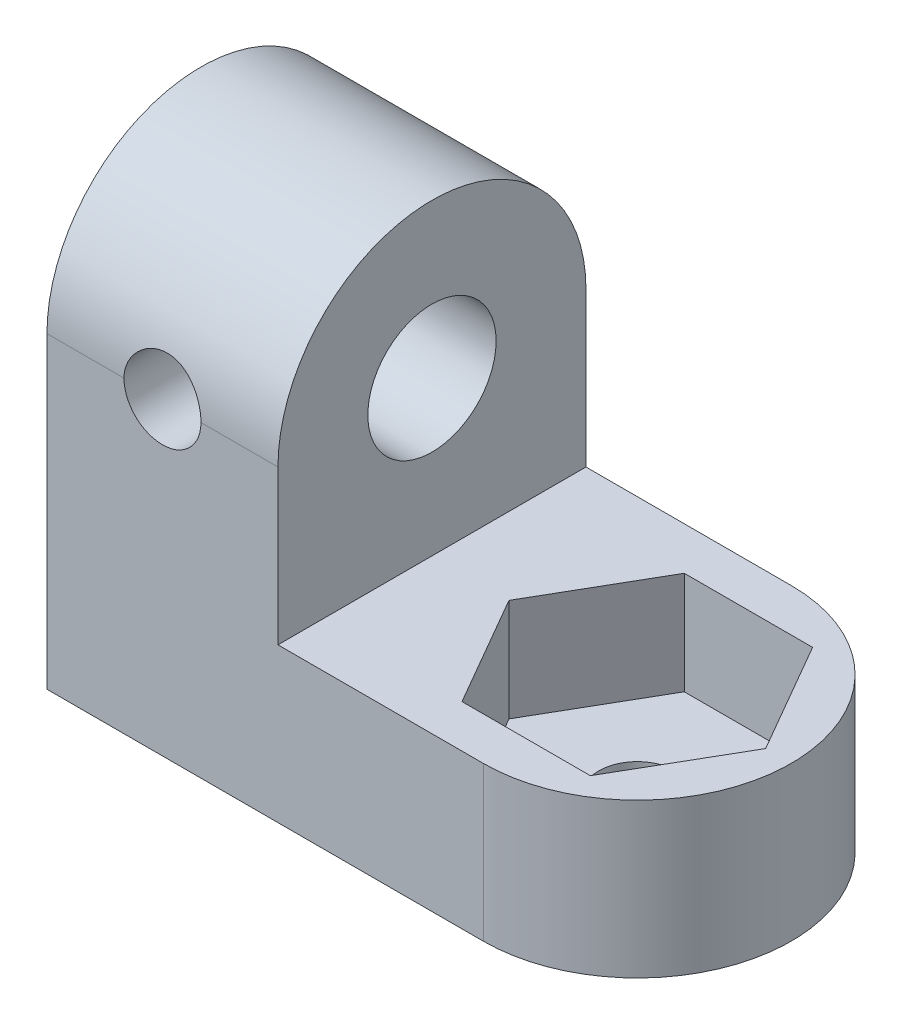
from build123d import *

# Parameters (mm, degrees)
EXTRUDE_1_DEPTH          = 6
CUT_EXTRUDE_1_DEPTH      = 4
SKETCH_3_R               = 1.5
CUT_EXTRUDE_2_DEPTH      = 4
SKETCH_5_W               = 9
SKETCH_5_H               = 12
EXTRUDE_2_DEPTH          = 12
CUT_EXTRUDE_3_DEPTH      = 30.816103032
SKETCH_9_R               = 2.5
CUT_EXTRUDE_6_DEPTH      = 24.579652245
CUT_EXTRUDE_7_DEPTH      = 26.475478406
CUT_EXTRUDE_7_DEPTH_BACK = 26.475478406
SKETCH_10_R              = 1.5


with BuildPart() as part:
    # 草图1 → 凸台-拉伸1 (new body)
    with BuildSketch(Plane(origin=(0, 0, 0), x_dir=(1, 0, 0), z_dir=(0, 1, 0))):
        with BuildLine():
            ThreePointArc((0, -6), (-6, 0), (0, 6))
            Line((0, 6), (-6, 6))
            Line((-6, 6), (-17, 6))
            Line((-17, 6), (-17, -6))
            Line((-17, -6), (0, -6))
        make_face()
        with BuildLine():
            Line((0, -6), (0, 0))
            Line((0, 0), (0, 6))
            ThreePointArc((0, 6), (-6, 0), (0, -6))
        make_face()
        with BuildLine():
            Line((0, 6), (0, 0))
            Line((0, 0), (0, -6))
            ThreePointArc((0, -6), (4.242640687, -4.242640687), (6, 0))
            ThreePointArc((6, 0), (4.242640687, 4.242640687), (0, 6))
        make_face()
    extrude(amount=EXTRUDE_1_DEPTH)

    # 草图2 → 切除-拉伸1 (cut)
    with BuildSketch(Plane(origin=(0, 6, 0), x_dir=(1, 0, 0), z_dir=(0, 1, 0))):
        Polygon((2.5, -4.330127019), (5, 0), (2.5, 4.330127019), (-2.5, 4.330127019), (-5, 0), (-2.5, -4.330127019), align=None)
    extrude(amount=-CUT_EXTRUDE_1_DEPTH, mode=Mode.SUBTRACT)

    # 草图3 → 切除-拉伸2 (cut)
    with BuildSketch(Plane.XZ):
        with Locations(Location((0, 0, 0), (0, 0, 270))):
            Circle(SKETCH_3_R)
    extrude(amount=-CUT_EXTRUDE_2_DEPTH, mode=Mode.SUBTRACT)

    # 草图5 → 凸台-拉伸2 (add)
    with BuildSketch(Plane(origin=(0, 6, 0), x_dir=(1, 0, 0), z_dir=(0, 1, 0))):
        with Locations((-12.5, 0)):
            Rectangle(SKETCH_5_W, SKETCH_5_H)
    extrude(amount=EXTRUDE_2_DEPTH)

    # 草图6 → 切除-拉伸3 (cut, through all)
    with BuildSketch(Plane.ZY.offset(17)):
        with BuildLine():
            Line((0, 18), (-6, 18))
            Line((-6, 18), (-6, 12))
            ThreePointArc((-6, 12), (-4.242640687, 16.242640687), (0, 18))
        make_face()
        with BuildLine():
            Line((6, 18), (0, 18))
            ThreePointArc((0, 18), (4.242640687, 16.242640687), (6, 12))
            Line((6, 12), (6, 18))
        make_face()
    extrude(amount=-CUT_EXTRUDE_3_DEPTH, mode=Mode.SUBTRACT)

    # 草图9 → 切除-拉伸6 (cut, through all)
    with BuildSketch(Plane(origin=(-8, 0, 0), x_dir=(0, 0, -1), z_dir=(1, 0, 0))):
        with Locations((0, 12)):
            Circle(SKETCH_9_R)
    extrude(amount=-CUT_EXTRUDE_6_DEPTH, mode=Mode.SUBTRACT)

    # 草图10 → 切除-拉伸7 (cut, two sides: drawn at the far end of the back side and taken through both)
    with BuildSketch(Plane.XY.offset(-CUT_EXTRUDE_7_DEPTH_BACK)):
        with Locations((-12.5, 12)):
            Circle(SKETCH_10_R)
    extrude(amount=CUT_EXTRUDE_7_DEPTH + CUT_EXTRUDE_7_DEPTH_BACK, mode=Mode.SUBTRACT)


solid = part.part
